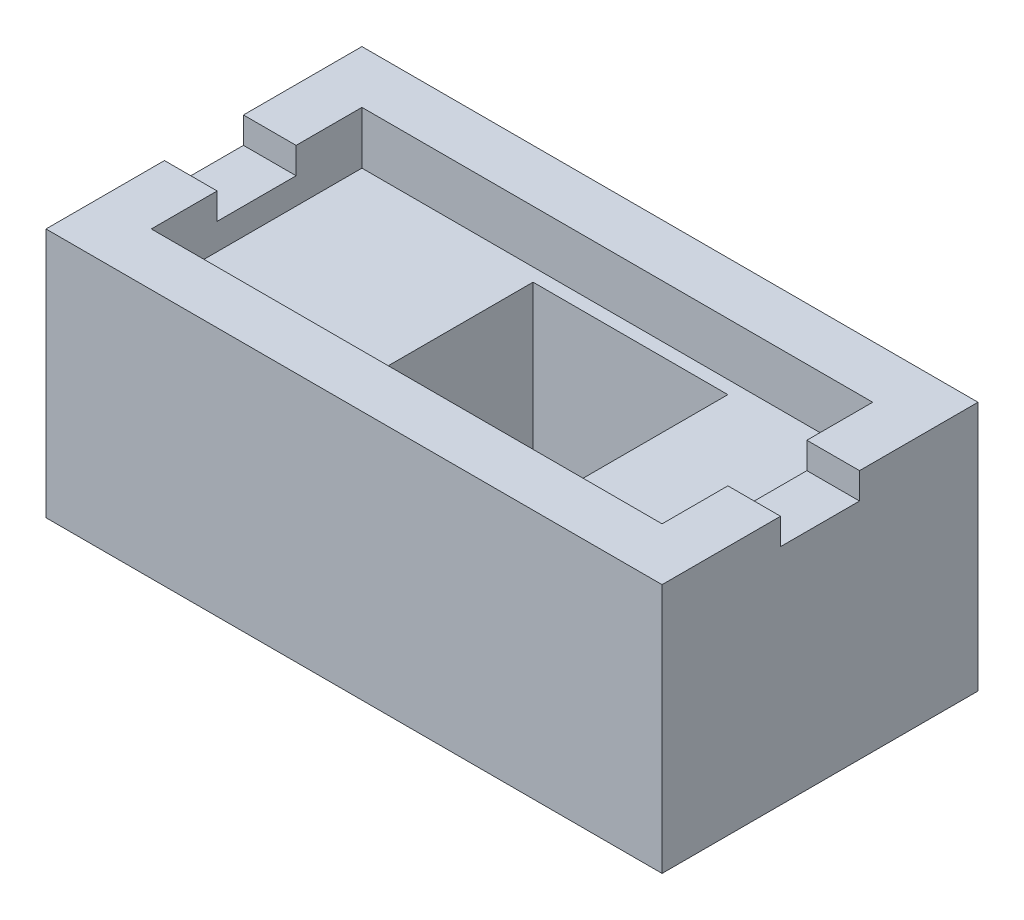
from build123d import *

# Parameters (mm, degrees)
SKETCH_1_W          = 23.4
SKETCH_1_H          = 12
SKETCH_1_W_2        = 7.4
SKETCH_1_H_2        = 7
EXTRUDE_1_DEPTH     = 9.5
CUT_EXTRUDE_START   = 9.5
SKETCH_1_4_W        = 23.4
SKETCH_1_4_H        = 3
CUT_EXTRUDE_2_DEPTH = 1
SKETCH_2_W          = 19.4
SKETCH_2_H          = 8
CUT_EXTRUDE_3_DEPTH = 2


with BuildPart() as part:
    # 草图1 → 凸台-拉伸1 (new body)
    with BuildSketch(Plane(origin=(0, 0, 0), x_dir=(1, 0, 0), z_dir=(0, 1, 0))):
        with Locations((11.7, -6)):
            Rectangle(SKETCH_1_W, SKETCH_1_H)
        with Locations((12.7, -6)):
            Rectangle(SKETCH_1_W_2, SKETCH_1_H_2, mode=Mode.SUBTRACT)
    extrude(amount=EXTRUDE_1_DEPTH)

    # 草图1<4> → 切除-拉伸2 (cut)
    with BuildSketch(Plane(origin=(0, 0, 0), x_dir=(1, 0, 0), z_dir=(0, 1, 0)).offset(CUT_EXTRUDE_START)):
        with Locations((11.7, -6)):
            Rectangle(SKETCH_1_4_W, SKETCH_1_4_H)
    extrude(amount=-CUT_EXTRUDE_2_DEPTH, mode=Mode.SUBTRACT)

    # 草图2 → 切除-拉伸3 (cut)
    with BuildSketch(Plane(origin=(0, 9.5, 0), x_dir=(1, 0, 0), z_dir=(0, 1, 0))):
        with Locations((11.7, -6)):
            Rectangle(SKETCH_2_W, SKETCH_2_H)
    extrude(amount=-CUT_EXTRUDE_3_DEPTH, mode=Mode.SUBTRACT)


solid = part.part
